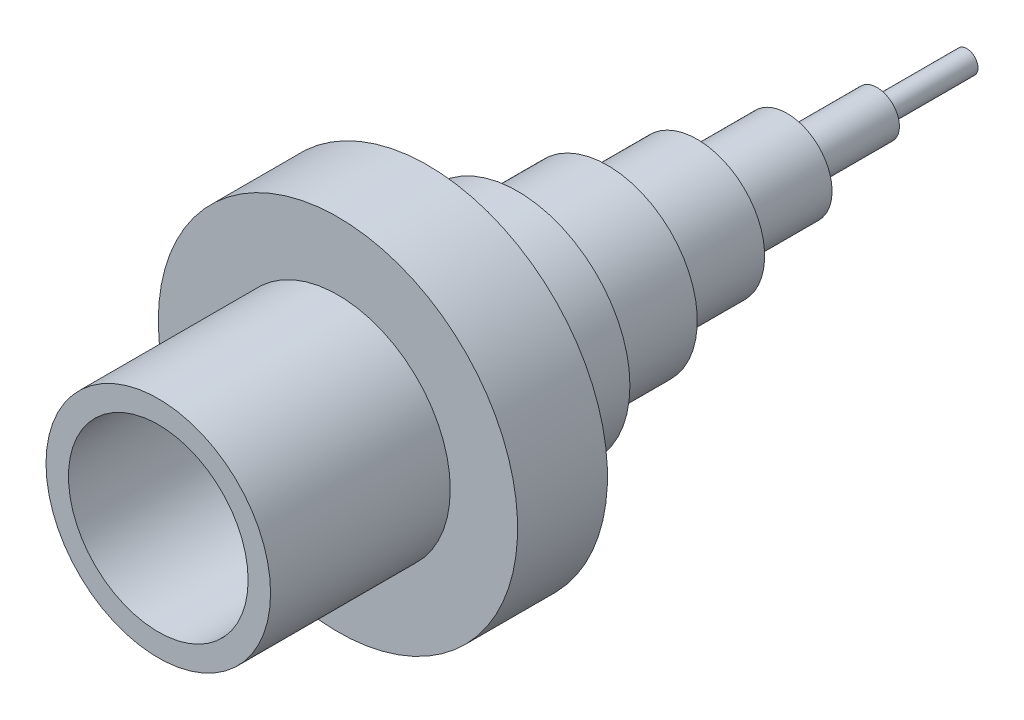
from build123d import *

# Parameters (mm, degrees)
SKETCH1_R           = 40
BOSS_EXTRUDE1_DEPTH = 90
SKETCH2_R           = 40
SKETCH2_R_2         = 25
SKETCH2_R_3         = 20
CUT_EXTRUDE2_DEPTH  = 40
CUT_EXTRUDE3_START  = -120
SKETCH4_R           = 40
SKETCH4_R_2         = 25
CUT_EXTRUDE3_DEPTH  = 120
CUT_EXTRUDE4_START  = -100
SKETCH5_R           = 25
SKETCH5_R_2         = 20
CUT_EXTRUDE4_DEPTH  = 100
CUT_EXTRUDE5_START  = -80
SKETCH6_R           = 20
SKETCH6_R_2         = 15
CUT_EXTRUDE5_DEPTH  = 80
CUT_EXTRUDE6_START  = -60
SKETCH7_R           = 15
SKETCH7_R_2         = 10
CUT_EXTRUDE6_DEPTH  = 60
CUT_EXTRUDE7_START  = -40
SKETCH8_R           = 10
SKETCH8_R_2         = 5
CUT_EXTRUDE7_DEPTH  = 40
CUT_EXTRUDE8_START  = -20
SKETCH9_R           = 5
SKETCH9_R_2         = 2.5
CUT_EXTRUDE8_DEPTH  = 20


with BuildPart() as part:
    # Sketch1 → Boss-Extrude1 (new, symmetric)
    with BuildSketch(Plane.XY):
        with Locations(Location((0, 0, 0), (0, 0, 180))):
            Circle(SKETCH1_R)
    extrude(amount=BOSS_EXTRUDE1_DEPTH, both=True)

    # Sketch2 → Cut-Extrude2 (cut)
    # profile 1 of 2: a face of its own
    with BuildSketch(Plane.XY.offset(90)):
        with Locations(Location((0, 0, 0), (0, 0, 180))):
            Circle(SKETCH2_R)
        Circle(SKETCH2_R_2, mode=Mode.SUBTRACT)
    # profile 2 of 2: a face of its own
    with BuildSketch(Plane.XY.offset(90)):
        Circle(SKETCH2_R_3)
    extrude(amount=-CUT_EXTRUDE2_DEPTH, mode=Mode.SUBTRACT)

    # Sketch4 → Cut-Extrude3 (cut)
    with BuildSketch(Plane(origin=(0, 0, -90), x_dir=(-1, 0, 0), z_dir=(0, 0, -1)).offset(CUT_EXTRUDE3_START)):
        Circle(SKETCH4_R)
        with Locations(Location((0, 0, 0), (0, 0, 180))):
            Circle(SKETCH4_R_2, mode=Mode.SUBTRACT)
    extrude(amount=CUT_EXTRUDE3_DEPTH, mode=Mode.SUBTRACT)

    # Sketch5 → Cut-Extrude4 (cut)
    with BuildSketch(Plane(origin=(0, 0, -90), x_dir=(-1, 0, 0), z_dir=(0, 0, -1)).offset(CUT_EXTRUDE4_START)):
        Circle(SKETCH5_R)
        with Locations(Location((0, 0, 0), (0, 0, 180))):
            Circle(SKETCH5_R_2, mode=Mode.SUBTRACT)
    extrude(amount=CUT_EXTRUDE4_DEPTH, mode=Mode.SUBTRACT)

    # Sketch6 → Cut-Extrude5 (cut)
    with BuildSketch(Plane(origin=(0, 0, -90), x_dir=(-1, 0, 0), z_dir=(0, 0, -1)).offset(CUT_EXTRUDE5_START)):
        Circle(SKETCH6_R)
        Circle(SKETCH6_R_2, mode=Mode.SUBTRACT)
    extrude(amount=CUT_EXTRUDE5_DEPTH, mode=Mode.SUBTRACT)

    # Sketch7 → Cut-Extrude6 (cut)
    with BuildSketch(Plane(origin=(0, 0, -90), x_dir=(-1, 0, 0), z_dir=(0, 0, -1)).offset(CUT_EXTRUDE6_START)):
        Circle(SKETCH7_R)
        Circle(SKETCH7_R_2, mode=Mode.SUBTRACT)
    extrude(amount=CUT_EXTRUDE6_DEPTH, mode=Mode.SUBTRACT)

    # Sketch8 → Cut-Extrude7 (cut)
    with BuildSketch(Plane(origin=(0, 0, -90), x_dir=(-1, 0, 0), z_dir=(0, 0, -1)).offset(CUT_EXTRUDE7_START)):
        Circle(SKETCH8_R)
        Circle(SKETCH8_R_2, mode=Mode.SUBTRACT)
    extrude(amount=CUT_EXTRUDE7_DEPTH, mode=Mode.SUBTRACT)

    # Sketch9 → Cut-Extrude8 (cut)
    with BuildSketch(Plane(origin=(0, 0, -90), x_dir=(-1, 0, 0), z_dir=(0, 0, -1)).offset(CUT_EXTRUDE8_START)):
        Circle(SKETCH9_R)
        Circle(SKETCH9_R_2, mode=Mode.SUBTRACT)
    extrude(amount=CUT_EXTRUDE8_DEPTH, mode=Mode.SUBTRACT)


solid = part.part
